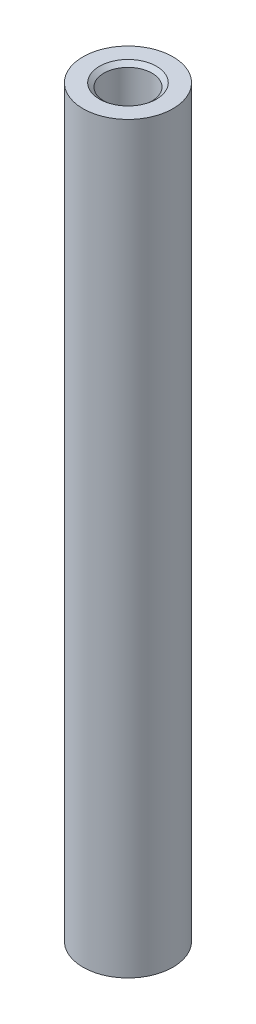
from build123d import *

# Parameters (mm, degrees)
SKETCH1_R                         = 6.35
BOSS_EXTRUDE1_DEPTH               = 104.9782
M8X1_25_TAPPED_HOLE1_D            = 6.8
M8X1_25_TAPPED_HOLE1_DEPTH        = 19.7612
M8X1_25_TAPPED_HOLE1_CSINK_D      = 8.05
M8X1_25_TAPPED_HOLE1_CSINK_ANGLE  = 100
M8X1_25_TAPPED_HOLE1_TIP          = 2.042926105
F_1_4_20_TAPPED_HOLE1_D           = 5.1054
F_1_4_20_TAPPED_HOLE1_DEPTH       = 16.51
F_1_4_20_TAPPED_HOLE1_CSINK_D     = 7.62
F_1_4_20_TAPPED_HOLE1_CSINK_ANGLE = 100
F_1_4_20_TAPPED_HOLE1_TIP         = 1.533816902


with BuildPart() as part:
    # Sketch1 → Boss-Extrude1 (new body)
    with BuildSketch(Plane(origin=(0, 0, 0), x_dir=(1, 0, 0), z_dir=(0, 1, 0))):
        with Locations(Location((0, 0, 0), (0, 0, 270))):
            Circle(SKETCH1_R)
    extrude(amount=BOSS_EXTRUDE1_DEPTH)

    # M8x1.25 Tapped Hole1
    with Locations(Plane(origin=(0, 104.9782, 0), x_dir=(1, 0, 0), z_dir=(0, 1, 0))):
        with Locations((0, 0)):
            CounterSinkHole(M8X1_25_TAPPED_HOLE1_D / 2, M8X1_25_TAPPED_HOLE1_CSINK_D / 2, depth=M8X1_25_TAPPED_HOLE1_DEPTH, counter_sink_angle=M8X1_25_TAPPED_HOLE1_CSINK_ANGLE)
            with Locations((0, 0, -(M8X1_25_TAPPED_HOLE1_DEPTH + M8X1_25_TAPPED_HOLE1_TIP / 2))):  # 118° drill point
                Cone(0, M8X1_25_TAPPED_HOLE1_D / 2, M8X1_25_TAPPED_HOLE1_TIP, mode=Mode.SUBTRACT)

    # 1/4-20 Tapped Hole1
    with Locations(Plane(origin=(0, 0, 0), x_dir=(-1, 0, 0), z_dir=(0, -1, 0))):
        with Locations((0, 0)):
            CounterSinkHole(F_1_4_20_TAPPED_HOLE1_D / 2, F_1_4_20_TAPPED_HOLE1_CSINK_D / 2, depth=F_1_4_20_TAPPED_HOLE1_DEPTH, counter_sink_angle=F_1_4_20_TAPPED_HOLE1_CSINK_ANGLE)
            with Locations((0, 0, -(F_1_4_20_TAPPED_HOLE1_DEPTH + F_1_4_20_TAPPED_HOLE1_TIP / 2))):  # 118° drill point
                Cone(0, F_1_4_20_TAPPED_HOLE1_D / 2, F_1_4_20_TAPPED_HOLE1_TIP, mode=Mode.SUBTRACT)


solid = part.part
